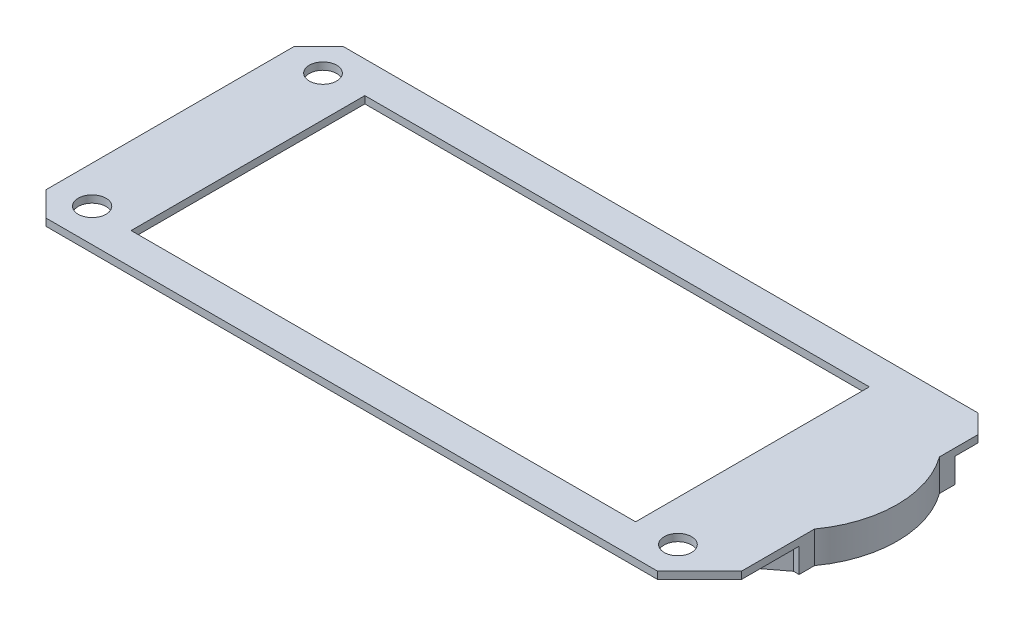
from build123d import *

# Parameters (mm, degrees)
SKETCH_1_W          = 34.967301983
SKETCH_1_H          = 16.2
EXTRUDE_1_DEPTH     = 0.5
EXTRUDE_START       = -1.7
EXTRUDE_2_DEPTH     = 1.7
SKETCH_2_R          = 0.950019994
SKETCH_2_R_2        = 0.963923892
SKETCH_2_R_3        = 0.95
CUT_EXTRUDE_4_DEPTH = 27.925670861


with BuildPart() as part:
    # Эскиз1 → Бобышка-Вытянуть1 (new body)
    with BuildSketch(Plane(origin=(0, 0, 0), x_dir=(1, 0, 0), z_dir=(0, 1, 0))):
        with BuildLine():
            Line((22.288172203, 9.255913898), (20.988172203, 10.555913898))
            Line((20.988172203, 10.555913898), (-23.011827797, 10.555913898))
            Line((-23.011827797, 10.555913898), (-24.711827797, 8.855913898))
            Line((-24.711827797, 8.855913898), (-24.711827797, -8.344086102))
            Line((-24.711827797, -8.344086102), (-23.011827797, -10.044086102))
            Line((-23.011827797, -10.044086102), (19.388172203, -10.044086102))
            Line((19.388172203, -10.044086102), (22.288172203, -7.144086102))
            Line((22.288172203, -7.144086102), (22.288172203, -2.075367667))
            ThreePointArc((22.288172203, -2.075367667), (23.688172203, 2.255913898), (22.288172203, 6.587195464))
            Line((22.288172203, 6.587195464), (22.288172203, 9.255913898))
        make_face()
        with Locations((-1.828176806, 0.255913898)):
            Rectangle(SKETCH_1_W, SKETCH_1_H, mode=Mode.SUBTRACT)
    extrude(amount=EXTRUDE_1_DEPTH)

    # Эскиз1<3> → Бобышка-Вытянуть2 (add)
    with BuildSketch(Plane(origin=(0, 0, 0), x_dir=(1, 0, 0), z_dir=(0, 1, 0)).offset(EXTRUDE_START)):
        with BuildLine():
            Line((22.288172203, 6.587195464), (22.288172203, 7.655913898))
            Line((22.288172203, 7.655913898), (21.931117854, 7.655913898))
            Line((21.931117854, 7.655913898), (20.432236612, 8.855913898))
            Line((20.432236612, 8.855913898), (18.488172203, 8.855913898))
            Line((18.488172203, 8.855913898), (18.488172203, 7.888602523))
            Line((18.488172203, 7.888602523), (16.255474186, 8.258604903))
            Line((16.255474186, 8.258604903), (16.255474186, -4.544086102))
            Line((16.255474186, -4.544086102), (19.028457532, -4.544086102))
            Line((19.028457532, -4.544086102), (19.028457532, -5.544086102))
            Line((19.028457532, -5.544086102), (19.928457532, -5.544086102))
            Line((19.928457532, -5.544086102), (19.928457532, -4.644944449))
            Line((19.928457532, -4.644944449), (21.901185097, -3.144086102))
            Line((21.901185097, -3.144086102), (22.288172203, -3.144086102))
            Line((22.288172203, -3.144086102), (22.288172203, -2.075367667))
            ThreePointArc((22.288172203, -2.075367667), (23.688172203, 2.255913898), (22.288172203, 6.587195464))
        make_face()
    extrude(amount=EXTRUDE_2_DEPTH)

    # Эскиз2 → Вырез-Вытянуть4 (cut, through all)
    with BuildSketch(Plane(origin=(0, 0, 0), x_dir=(1, 0, 0), z_dir=(0, 1, 0))):
        with Locations((-22.111827797, 8.255913898)):
            Circle(SKETCH_2_R)
        with Locations((-22.123719351, -7.736880442)):
            Circle(SKETCH_2_R_2)
        with Locations((18.488191089, -7.744092667)):
            Circle(SKETCH_2_R_3)
    extrude(amount=CUT_EXTRUDE_4_DEPTH, mode=Mode.SUBTRACT)


solid = part.part
